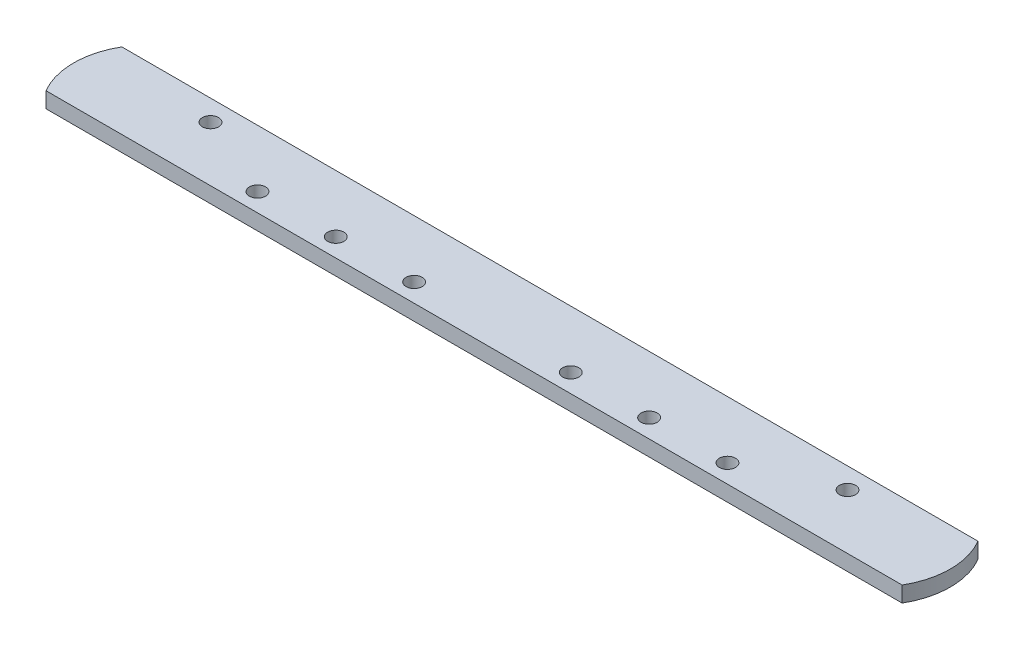
from build123d import *

# Parameters (mm, degrees)
SKETCH_2_R      = 1.55
EXTRUDE_2_DEPTH = 3


with BuildPart() as part:
    # 草图2 → 凸台-拉伸2 (new body)
    with BuildSketch(Plane(origin=(0, 0, 0), x_dir=(1, 0, 0), z_dir=(0, 1, 0))):
        with BuildLine():
            Line((-82.248200933, 7.399664194), (81.712545766, 7.399664194))
            ThreePointArc((81.712545766, 7.399664194), (83.687080801, 0.133913792), (81.712545766, -7.131836611))
            Line((81.712545766, -7.131836611), (-82.248200933, -7.131836611))
            ThreePointArc((-82.248200933, -7.131836611), (-84.222735969, 0.133913792), (-82.248200933, 7.399664194))
        make_face()
        with Locations(Location((-61.277484151, 3.399664194, 0), (0, 0, 270))):
            Circle(SKETCH_2_R, mode=Mode.SUBTRACT)
        with Locations(Location((-15.277484151, -3.600335806, 0), (0, 0, 270))):
            Circle(SKETCH_2_R, mode=Mode.SUBTRACT)
        with Locations(Location((14.722515849, -3.600335806, 0), (0, 0, 270))):
            Circle(SKETCH_2_R, mode=Mode.SUBTRACT)
        with Locations(Location((60.722515849, 3.399664194, 0), (0, 0, 270))):
            Circle(SKETCH_2_R, mode=Mode.SUBTRACT)
        with Locations(Location((-45.277484151, -3.600335806, 0), (0, 0, 270))):
            Circle(SKETCH_2_R, mode=Mode.SUBTRACT)
        with Locations(Location((-30.277484151, -3.600335806, 0), (0, 0, 270))):
            Circle(SKETCH_2_R, mode=Mode.SUBTRACT)
        with Locations(Location((29.722515849, -3.600335806, 0), (0, 0, 270))):
            Circle(SKETCH_2_R, mode=Mode.SUBTRACT)
        with Locations(Location((44.722515849, -3.600335806, 0), (0, 0, 270))):
            Circle(SKETCH_2_R, mode=Mode.SUBTRACT)
    extrude(amount=EXTRUDE_2_DEPTH)


solid = part.part
